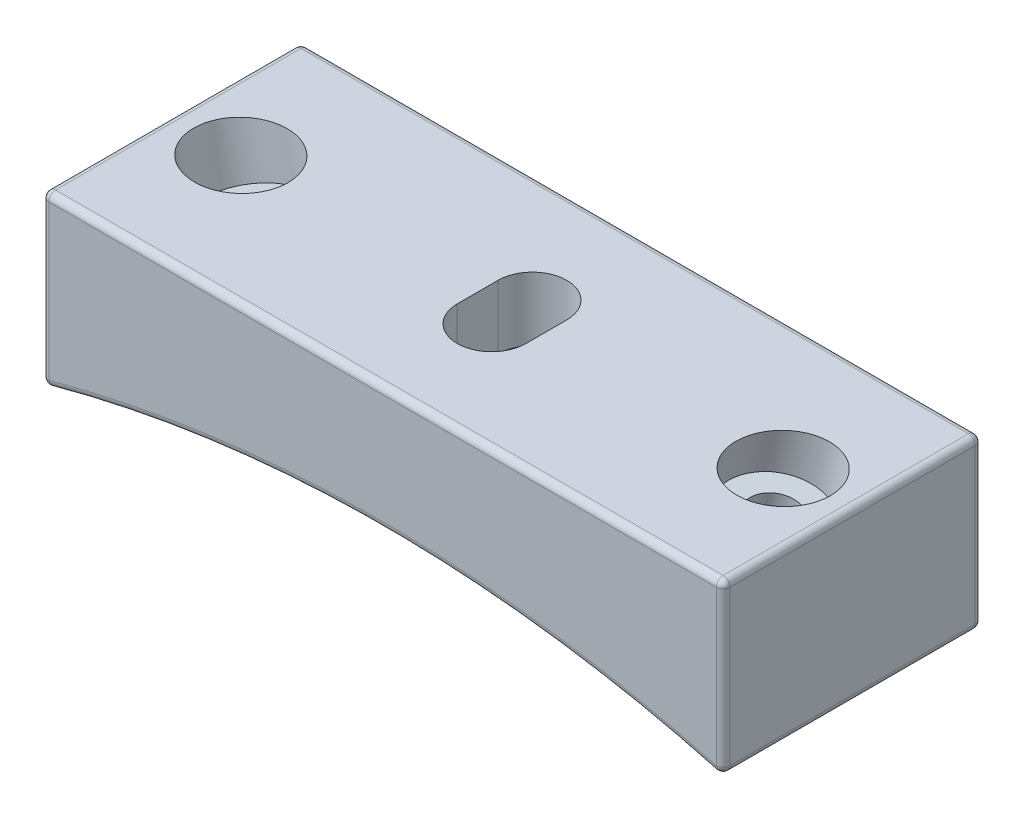
from build123d import *

# Parameters (mm, degrees)
BOSS_EXTRUDE1_DEPTH     = 24.13
FILLET1_R               = 0.635
CUT_EXTRUDE1_DEPTH      = 43.849527948
CUT_EXTRUDE6_DEPTH      = 42.512826607
CUT_EXTRUDE6_DEPTH_BACK = 5.588


with BuildPart() as part:
    # Sketch1 → Boss-Extrude1 (new body)
    with BuildSketch(Plane.XY):
        with BuildLine():
            Line((-31.75, 12.7), (31.75, 12.7))
            Line((31.75, 12.7), (31.75, -3.175))
            ThreePointArc((31.75, -3.175), (0, 1.167638116), (-31.75, -3.175))
            Line((-31.75, -3.175), (-31.75, 12.7))
        make_face()
    extrude(amount=BOSS_EXTRUDE1_DEPTH)

    # Sketch5 → Cut-Revolve1 (revolve, cut)
    with BuildSketch(Plane(origin=(0, 0, 12.065), x_dir=(-1, 0, 0), z_dir=(0, 0, -1)), mode=Mode.PRIVATE) as cut_revolve1_sk:
        Polygon((-22.482530384, -1.647401081), (-24.72635964, -2.084466602), (-26.680337626, 7.946965208), (-28.67485252, 7.558462523), (-30.361328492, 16.216578855), (-26.122984342, 17.042147061), align=None)
    cut_revolve1 = revolve(cut_revolve1_sk.sketch.rotate(Axis((26.472561187, 18.836822495, 12.065), (-0.19119226638023634, -0.9815526054554533, 0)), 180), axis=Axis((26.472561187, 18.836822495, 12.065), (-0.19119226638023634, -0.9815526054554533, 0)), mode=Mode.SUBTRACT)

    # Mirror1: Cut-Revolve1 across plane
    add(cut_revolve1.mirror(Plane(origin=(0, 0, 0), x_dir=(0, 0, 1), z_dir=(1, 0, 0))), mode=Mode.SUBTRACT)

    # Fillet1
    fillet1_edges = [part.edges().sort_by_distance(p)[0] for p in [
        (0, 12.7, 24.13),
        (-31.75, 4.7625, 24.13),
        (0, 1.167638116, 24.13),
        (-31.75, 4.7625, 0),
        (0, 12.7, 0),
        (31.75, 4.7625, 0),
        (0, 1.167638116, 0),
        (31.75, 4.7625, 24.13),
        (-31.75, -3.175, 12.065),
        (-31.75, 12.7, 12.065),
        (31.75, 12.7, 12.065),
        (31.75, -3.175, 12.065),
    ]]
    fillet(fillet1_edges, radius=FILLET1_R)

    # Sketch17 → Cut-Extrude1 (cut, through all)
    with BuildSketch(Plane(origin=(0, 12.7, 0), x_dir=(1, 0, 0), z_dir=(0, 1, 0))):
        with BuildLine():
            Line((-3.2004, -13.97), (-3.2004, -10.16))
            ThreePointArc((-3.2004, -10.16), (0, -6.9596), (3.2004, -10.16))
            Line((3.2004, -10.16), (3.2004, -13.97))
            ThreePointArc((3.2004, -13.97), (0, -17.1704), (-3.2004, -13.97))
        make_face()
    extrude(amount=-CUT_EXTRUDE1_DEPTH, mode=Mode.SUBTRACT)

    # Sketch18 → Cut-Extrude6 (cut, two sides: drawn at the far end of the back side and taken through both)
    with BuildSketch(Plane(origin=(0, 1.167638116, 0), x_dir=(-1, 0, 0), z_dir=(0, -1, 0)).offset(-CUT_EXTRUDE6_DEPTH_BACK)):
        with BuildLine():
            Line((8.382, -10.16), (8.382, -13.97))
            ThreePointArc((8.382, -13.97), (0, -22.352), (-8.382, -13.97))
            Line((-8.382, -13.97), (-8.382, -10.16))
            ThreePointArc((-8.382, -10.16), (0, -1.778), (8.382, -10.16))
        make_face()
    extrude(amount=CUT_EXTRUDE6_DEPTH + CUT_EXTRUDE6_DEPTH_BACK, mode=Mode.SUBTRACT)


solid = part.part
